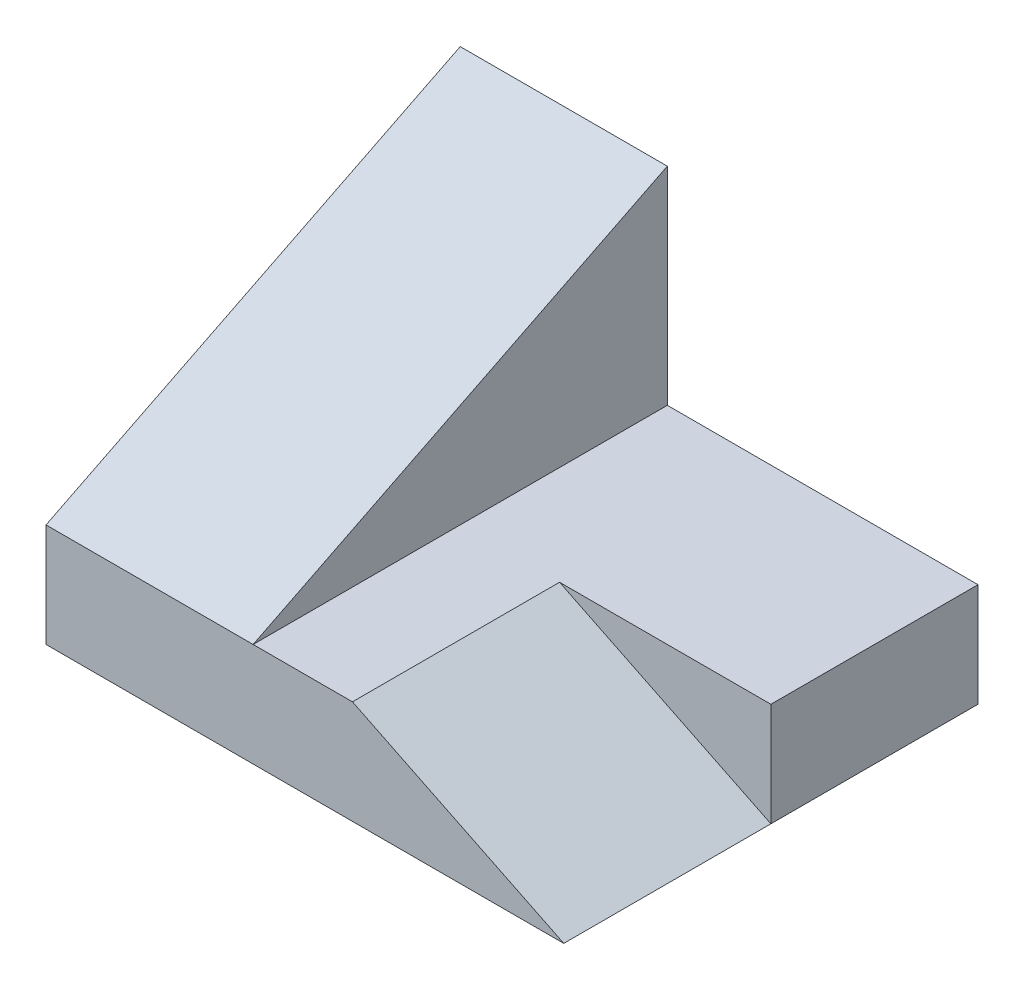
from build123d import *

# Parameters (mm, degrees)
SKETCH1_W           = 50
SKETCH1_H           = 40
BOSS_EXTRUDE4_DEPTH = 10
CUT_EXTRUDE1_DEPTH  = 20
SKETCH9_W           = 20
SKETCH9_H           = 40
BOSS_EXTRUDE5_DEPTH = 20
CUT_EXTRUDE3_DEPTH  = 20


with BuildPart() as part:
    # Sketch1 → Boss-Extrude4 (new body)
    with BuildSketch(Plane(origin=(0, 0, 0), x_dir=(1, 0, 0), z_dir=(0, 1, 0))):
        with Locations((25, 20)):
            Rectangle(SKETCH1_W, SKETCH1_H)
    extrude(amount=BOSS_EXTRUDE4_DEPTH)

    # Sketch8 → Cut-Extrude1 (cut)
    with BuildSketch(Plane.XY):
        Polygon((50, 0), (50, 10), (29.592919786, 10), align=None)
    extrude(amount=-CUT_EXTRUDE1_DEPTH, mode=Mode.SUBTRACT)

    # Sketch9 → Boss-Extrude5 (add)
    with BuildSketch(Plane(origin=(0, 10, 0), x_dir=(1, 0, 0), z_dir=(0, 1, 0))):
        with Locations((10, 20)):
            Rectangle(SKETCH9_W, SKETCH9_H)
    extrude(amount=BOSS_EXTRUDE5_DEPTH)

    # Sketch10 → Cut-Extrude3 (cut)
    with BuildSketch(Plane.ZY):
        Polygon((-40, 30), (0, 30), (0, 10), align=None)
    extrude(amount=-CUT_EXTRUDE3_DEPTH, mode=Mode.SUBTRACT)


solid = part.part
